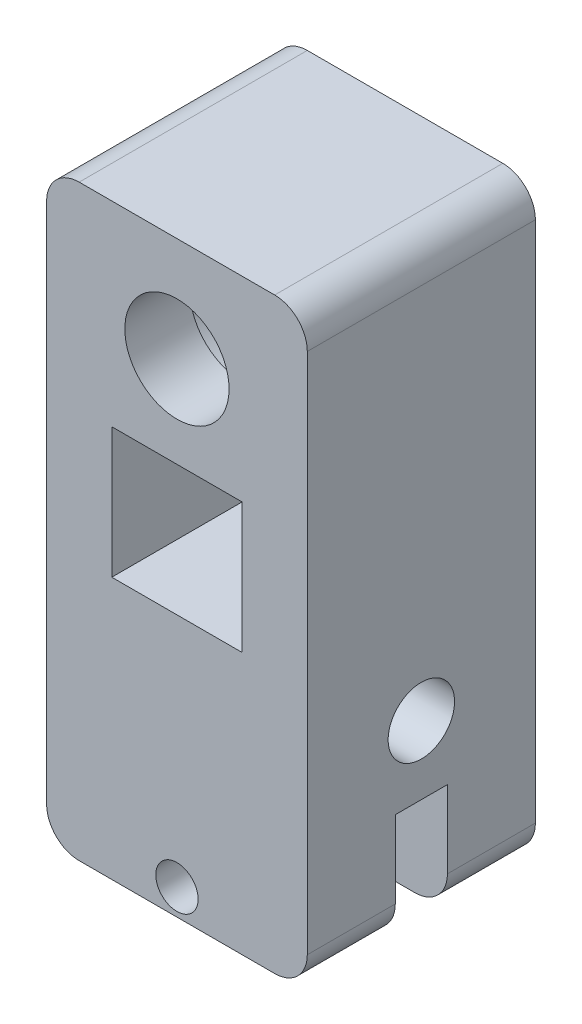
from build123d import *

# Parameters (mm, degrees)
CROQUIS1_R              = 12
CROQUIS1_R_2            = 3.25
SALIENTE_EXTRUIR1_DEPTH = 35
SALIENTE_EXTRUIR2_START = -10
CROQUIS2_R              = 12
CROQUIS2_R_2            = 8
SALIENTE_EXTRUIR2_DEPTH = 10
CROQUIS3_R              = 5.1
CROQUIS3_W              = 8
CROQUIS3_H              = 16.86
CORTAR_EXTRUIR2_DEPTH   = 105.669140151


with BuildPart() as part:
    # Croquis1 → Saliente-Extruir1 (new body)
    # profile 1 of 2: a face of its own
    with BuildSketch(Plane.XY):
        with BuildLine():
            Line((0, 85.17), (0, 40.17))
            Line((0, 40.17), (10, 40.17))
            Line((10, 40.17), (10, 60.17))
            Line((10, 60.17), (30, 60.17))
            Line((30, 60.17), (30, 40.17))
            Line((30, 40.17), (40, 40.17))
            Line((40, 40.17), (40, 85.17))
            ThreePointArc((40, 85.17), (38.535533906, 88.705533906), (35, 90.17))
            Line((35, 90.17), (5, 90.17))
            ThreePointArc((5, 90.17), (1.464466094, 88.705533906), (0, 85.17))
        make_face()
        with Locations((20, 74.17)):
            Circle(CROQUIS1_R, mode=Mode.SUBTRACT)
    # profile 2 of 2: a face of its own
    with BuildSketch(Plane.XY):
        with BuildLine():
            Line((5, 0), (35, 0))
            ThreePointArc((35, 0), (38.535533906, 1.464466094), (40, 5))
            Line((40, 5), (40, 40.17))
            Line((40, 40.17), (0, 40.17))
            Line((0, 40.17), (0, 5))
            ThreePointArc((0, 5), (1.464466094, 1.464466094), (5, 0))
        make_face()
        with Locations((20, 4)):
            Circle(CROQUIS1_R_2, mode=Mode.SUBTRACT)
    extrude(amount=SALIENTE_EXTRUIR1_DEPTH)

    # Croquis2 → Saliente-Extruir2 (add)
    with BuildSketch(Plane.XY.offset(35).offset(SALIENTE_EXTRUIR2_START)):
        with Locations((20, 74.17)):
            Circle(CROQUIS2_R)
        with Locations((20, 74.17)):
            Circle(CROQUIS2_R_2, mode=Mode.SUBTRACT)
    extrude(amount=SALIENTE_EXTRUIR2_DEPTH)

    # Croquis3 → Cortar-Extruir2 (cut, through all)
    with BuildSketch(Plane.ZY):
        with Locations((17.5, 27.36)):
            Circle(CROQUIS3_R)
        with Locations((17.5, 8.43)):
            Rectangle(CROQUIS3_W, CROQUIS3_H)
    extrude(amount=-CORTAR_EXTRUIR2_DEPTH, mode=Mode.SUBTRACT)


solid = part.part
